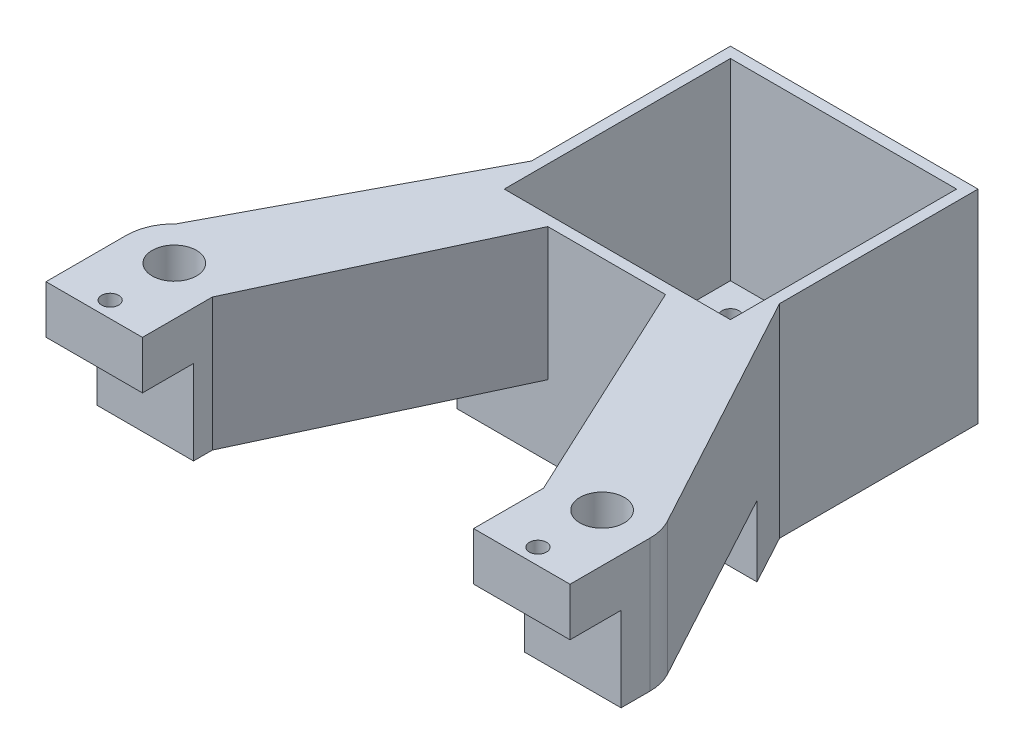
from build123d import *

# Parameters (mm, degrees)
SKETCH_6_W           = 42.3
SKETCH_6_H           = 42.3
SKETCH_6_R           = 1.6
SKETCH_6_R_2         = 15
EXTRUDE_1_DEPTH      = 5
SKETCH_7_R           = 1.6
SKETCH_7_R_2         = 4.15
EXTRUDE_5_DEPTH      = 38
EXTRUDE_START        = 38
SKETCH_7_7_R         = 4.15
SKETCH_7_7_R_2       = 1.6
EXTRUDE_7_DEPTH      = 38
SKETCH_7_8_R         = 4.15
SKETCH_7_8_R_2       = 1.6
EXTRUDE_8_DEPTH      = 38
SKETCH_12_W          = 2
SKETCH_12_H          = 44.3
EXTRUDE_11_DEPTH     = 38
SKETCH_14_W          = 44.3
SKETCH_14_H          = 2
EXTRUDE_12_DEPTH     = 38
SKETCH_15_W          = 2
SKETCH_15_H          = 42.3
EXTRUDE_13_DEPTH     = 38
CUT_EXTRUDE_1_DEPTH  = 13.2
CUT_EXTRUDE_2_DEPTH  = 123
SKETCH_19_R          = 1.5
CUT_EXTRUDE_3_DEPTH  = 10
EXTRUDE_15_DEPTH     = 11.2
EXTRUDE_16_DEPTH     = 11.2
EXTRUDE_17_DEPTH     = 2
SKETCH_26_R          = 1.6
SKETCH_26_R_2        = 15
CUT_EXTRUDE_10_DEPTH = 2
SKETCH_27_W          = 42.3
SKETCH_27_H          = 42.3
CUT_EXTRUDE_12_DEPTH = 5
SKETCH_29_W          = 46.3
SKETCH_29_H          = 38
EXTRUDE_18_DEPTH     = 2


with BuildPart() as part:
    # 草图6 → 凸台-拉伸1 (new body)
    with BuildSketch(Plane(origin=(0, 0, 0), x_dir=(1, 0, 0), z_dir=(0, 1, 0))):
        Rectangle(SKETCH_6_W, SKETCH_6_H)
        with Locations(Location((15.5, 15.5, 0), (0, 0, 270))):
            Circle(SKETCH_6_R, mode=Mode.SUBTRACT)
        with Locations(Location((-15.5, 15.5, 0), (0, 0, 270))):
            Circle(SKETCH_6_R, mode=Mode.SUBTRACT)
        with Locations(Location((-15.5, -15.5, 0), (0, 0, 270))):
            Circle(SKETCH_6_R, mode=Mode.SUBTRACT)
        with Locations(Location((15.5, -15.5, 0), (0, 0, 270))):
            Circle(SKETCH_6_R, mode=Mode.SUBTRACT)
        with Locations(Location((0, 0, 0), (0, 0, 270))):
            Circle(SKETCH_6_R_2, mode=Mode.SUBTRACT)
    extrude(amount=EXTRUDE_1_DEPTH)

    # 草图7 → 凸台-拉伸5 (add)
    # profile 1 of 2: a face of its own
    with BuildSketch(Plane(origin=(0, 5, 0), x_dir=(1, 0, 0), z_dir=(0, 1, 0))):
        with BuildLine():
            Line((49, -79), (49, -64))
            ThreePointArc((49, -64), (48.724429591, -61.789948347), (47.914593709, -59.715235547))
            Line((47.914593709, -59.715235547), (21.15, -10.277072187))
            Line((21.15, -10.277072187), (21.15, -21.15))
            Line((21.15, -21.15), (10.070005019, -21.15))
            Line((10.070005019, -21.15), (30.963898233, -65.919418373))
            Line((30.963898233, -65.919418373), (30.963898233, -79))
            Line((30.963898233, -79), (49, -79))
        make_face()
        with Locations(Location((40, -76, 0), (0, 0, 270))):
            Circle(SKETCH_7_R, mode=Mode.SUBTRACT)
        with Locations(Location((40, -64, 0), (0, 0, 270))):
            Circle(SKETCH_7_R_2, mode=Mode.SUBTRACT)
    # profile 2 of 2: a face of its own
    with BuildSketch(Plane(origin=(0, 5, 0), x_dir=(1, 0, 0), z_dir=(0, 1, 0))):
        with BuildLine():
            Line((-30.963898233, -65.919418373), (-10.070005019, -21.15))
            Line((-10.070005019, -21.15), (-21.15, -21.15))
            Line((-21.15, -21.15), (-21.15, -10.282583808))
            Line((-21.15, -10.282583808), (-46.202269248, -57.478354795))
            ThreePointArc((-46.202269248, -57.478354795), (-48.271046585, -60.45179082), (-49, -64))
            Line((-49, -64), (-49, -79))
            Line((-49, -79), (-30.963898233, -79))
            Line((-30.963898233, -79), (-30.963898233, -65.919418373))
        make_face()
        with Locations(Location((-40, -76, 0), (0, 0, 270))):
            Circle(SKETCH_7_R, mode=Mode.SUBTRACT)
        with Locations(Location((-40, -64, 0), (0, 0, 270))):
            Circle(SKETCH_7_R_2, mode=Mode.SUBTRACT)
    extrude(amount=-EXTRUDE_5_DEPTH)

    # 草图7<7> → 凸台-拉伸7 (add)
    with BuildSketch(Plane(origin=(0, 5, 0), x_dir=(1, 0, 0), z_dir=(0, 1, 0)).offset(EXTRUDE_START)):
        with Locations(Location((-40, -64, 0), (0, 0, 270))):
            Circle(SKETCH_7_7_R)
        with Locations(Location((40, -64, 0), (0, 0, 270))):
            Circle(SKETCH_7_7_R)
        with Locations(Location((40, -76, 0), (0, 0, 270))):
            Circle(SKETCH_7_7_R_2)
        with Locations(Location((-40, -76, 0), (0, 0, 270))):
            Circle(SKETCH_7_7_R_2)
    extrude(amount=-EXTRUDE_7_DEPTH)


with BuildPart() as extrude_7_kept_piece:
    # of the separate pieces the step leaves, the one the design keeps (extrude_7_pieces_kept)
    add(part.part.solids().sort_by_distance((-10.070005019, 0, 21.15))[0])

    # 草图7<8> → 凸台-拉伸8 (add)
    with BuildSketch(Plane(origin=(0, 5, 0), x_dir=(1, 0, 0), z_dir=(0, 1, 0))):
        with Locations(Location((-40, -64, 0), (0, 0, 270))):
            Circle(SKETCH_7_8_R)
        with Locations(Location((40, -64, 0), (0, 0, 270))):
            Circle(SKETCH_7_8_R)
        with Locations(Location((40, -76, 0), (0, 0, 270))):
            Circle(SKETCH_7_8_R_2)
        with Locations(Location((-40, -76, 0), (0, 0, 270))):
            Circle(SKETCH_7_8_R_2)
    extrude(amount=EXTRUDE_8_DEPTH)


with BuildPart() as extrude_8_kept_piece:
    # of the separate pieces the step leaves, the one the design keeps (extrude_8_pieces_kept)
    add(extrude_7_kept_piece.part.solids().sort_by_distance((-10.070005019, 0, 21.15))[0])

    # 草图12 → 凸台-拉伸11 (add)
    with BuildSketch(Plane(origin=(0, 5, 0), x_dir=(1, 0, 0), z_dir=(0, 1, 0))):
        with Locations((22.15, -1)):
            Rectangle(SKETCH_12_W, SKETCH_12_H)
    extrude(amount=-EXTRUDE_11_DEPTH)

    # 草图14 → 凸台-拉伸12 (add)
    with BuildSketch(Plane(origin=(0, 5, 0), x_dir=(1, 0, 0), z_dir=(0, 1, 0))):
        with Locations((-1, -22.15)):
            Rectangle(SKETCH_14_W, SKETCH_14_H)
    extrude(amount=-EXTRUDE_12_DEPTH)

    # 草图15 → 凸台-拉伸13 (add)
    with BuildSketch(Plane(origin=(0, 5, 0), x_dir=(1, 0, 0), z_dir=(0, 1, 0))):
        with Locations((-22.15, 0)):
            Rectangle(SKETCH_15_W, SKETCH_15_H)
    extrude(amount=-EXTRUDE_13_DEPTH)

    # 草图17 → 切除-拉伸1 (cut)
    with BuildSketch(Plane.XZ.offset(33)):
        Polygon((62.040525686, 30.953335803), (62.040525686, -32.044280047), (-61.83718559, -32.044280047), (-61.83718559, 30.953335803), (-61.83718559, 85.06296978), (-8.604799232, 85.06296978), (62.040525686, 85.06296978), align=None)
    extrude(amount=-CUT_EXTRUDE_1_DEPTH, mode=Mode.SUBTRACT)

    # 草图18 → 切除-拉伸2 (cut)
    with BuildSketch(Plane(origin=(49, 0, 0), x_dir=(0, 0, -1), z_dir=(1, 0, 0))):
        Polygon((-79, -4), (-69.450510985, -4), (-69.450510985, -12.643215043), (-69.450510985, -19.8), (-79, -19.8), (-79, -12.643215043), align=None)
    extrude(amount=-CUT_EXTRUDE_2_DEPTH, mode=Mode.SUBTRACT)

    # 草图19 → 切除-拉伸3 (cut)
    with BuildSketch(Plane(origin=(0, 0, 0), x_dir=(-1, 0, 0), z_dir=(0, -1, 0))):
        with Locations(Location((0, -17.95, 0), (0, 0, 90))):
            Circle(SKETCH_19_R)
        with Locations(Location((0, 17.95, 0), (0, 0, 90))):
            Circle(SKETCH_19_R)
    extrude(amount=-CUT_EXTRUDE_3_DEPTH, mode=Mode.SUBTRACT)

    # 草图23 → 凸台-拉伸15 (add)
    with BuildSketch(Plane(origin=(0, -19.8, 0), x_dir=(-1, 0, 0), z_dir=(0, -1, 0))):
        Polygon((-21.15, 21.15), (-23.15, 21.15), (-23.15, -13.971368009), (-23.15, -23.15), (-11.003405272, -23.15), (11.003405272, -23.15), (23.15, -23.15), (23.15, -14.050367917), (23.15, 21.15), (21.15, 21.15), (21.15, -21.15), (-21.15, -21.15), align=None)
    extrude(amount=EXTRUDE_15_DEPTH)

    # 草图24 → 凸台-拉伸16 (add)
    with BuildSketch(Plane(origin=(0, -19.8, 0), x_dir=(-1, 0, 0), z_dir=(0, -1, 0))):
        Polygon((23.15, -23.15), (27.980230087, -23.15), (23.15, -14.050367917), align=None)
        Polygon((-23.15, -23.15), (-28.119083383, -23.15), (-23.15, -13.971368009), align=None)
    extrude(amount=EXTRUDE_16_DEPTH)

    # 草图25 → 凸台-拉伸17 (add)
    with BuildSketch(Plane.XZ.offset(31)):
        Polygon((28.119083383, 23.15), (-27.980230087, 23.15), (-23.15, 14.050367917), (-23.15, -21.15), (23.15, -21.15), (23.15, 13.971368009), align=None)
    extrude(amount=EXTRUDE_17_DEPTH)

    # 草图26 → 切除-拉伸10 (cut)
    with BuildSketch(Plane.XZ.offset(33)):
        with Locations(Location((-15.5, 15.5, 0), (0, 0, 90))):
            Circle(SKETCH_26_R)
        with Locations(Location((15.5, 15.5, 0), (0, 0, 90))):
            Circle(SKETCH_26_R)
        with Locations(Location((15.5, -15.5, 0), (0, 0, 90))):
            Circle(SKETCH_26_R)
        with Locations(Location((-15.5, -15.5, 0), (0, 0, 90))):
            Circle(SKETCH_26_R)
        with Locations(Location((0, 0, 0), (0, 0, 90))):
            Circle(SKETCH_26_R_2)
    extrude(amount=-CUT_EXTRUDE_10_DEPTH, mode=Mode.SUBTRACT)

    # 草图27 → 切除-拉伸12 (cut)
    with BuildSketch(Plane.XZ):
        Rectangle(SKETCH_27_W, SKETCH_27_H)
    extrude(amount=-CUT_EXTRUDE_12_DEPTH, mode=Mode.SUBTRACT)

    # 草图29 → 凸台-拉伸18 (add)
    with BuildSketch(Plane(origin=(0, 0, -21.15), x_dir=(-1, 0, 0), z_dir=(0, 0, -1))):
        with Locations((0, -14)):
            Rectangle(SKETCH_29_W, SKETCH_29_H)
    extrude(amount=EXTRUDE_18_DEPTH)


solid = extrude_8_kept_piece.part
